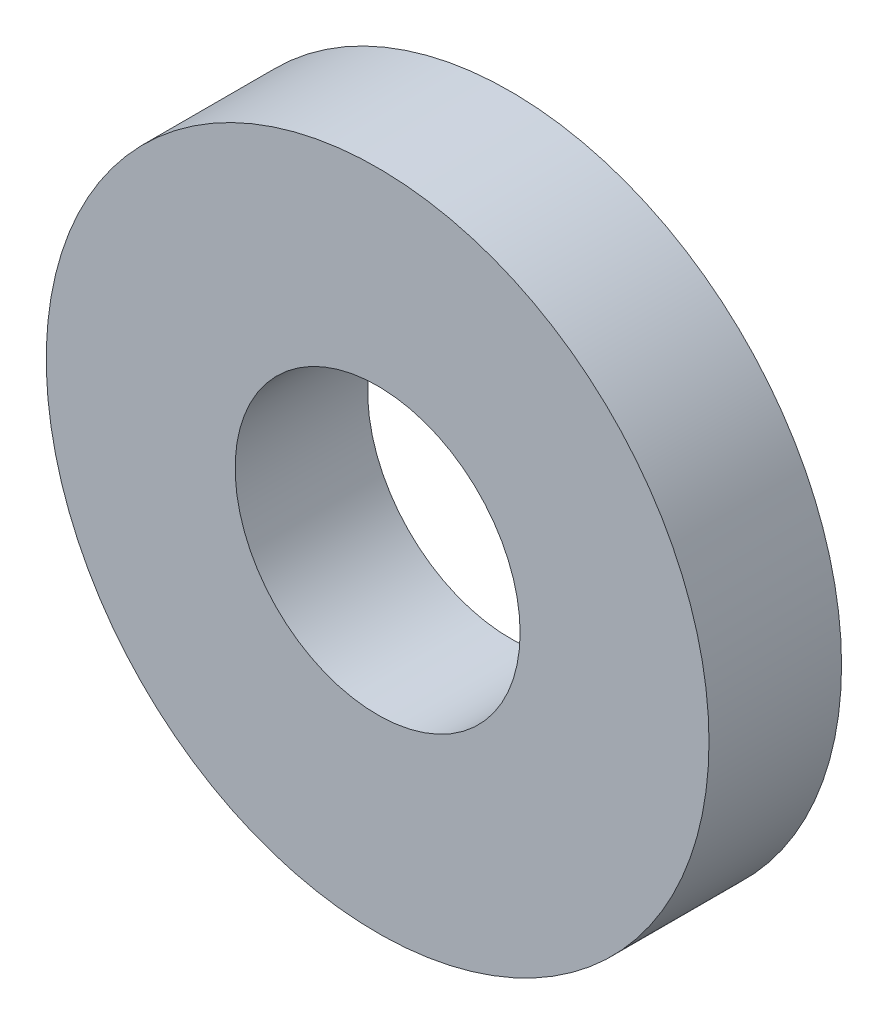
from build123d import *

# Parameters (mm, degrees)
SKETCH_1_R      = 5
SKETCH_1_R_2    = 2.15
EXTRUDE_1_DEPTH = 2


with BuildPart() as part:
    # 草图1 → 凸台-拉伸1 (new body)
    with BuildSketch(Plane.XY):
        Circle(SKETCH_1_R)
        Circle(SKETCH_1_R_2, mode=Mode.SUBTRACT)
    extrude(amount=EXTRUDE_1_DEPTH)


solid = part.part
